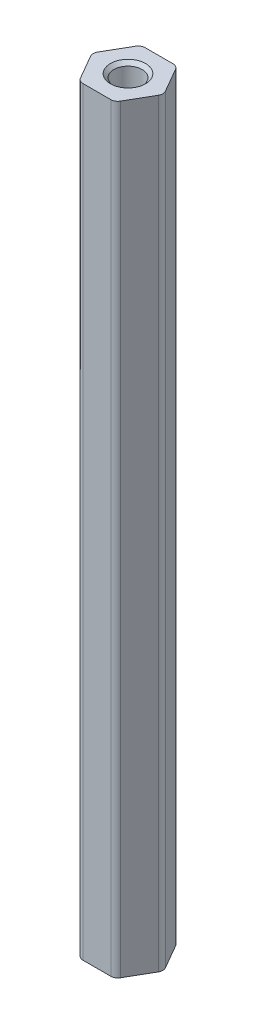
from build123d import *

# Parameters (mm, degrees)
BOSS_EXTRUDE1_DEPTH                = 55.0672
FILLET1_R                          = 0.508
M2_5X0_45_TAPPED_HOLE1_D           = 2.05
M2_5X0_45_TAPPED_HOLE1_CSINK_D     = 2.55
M2_5X0_45_TAPPED_HOLE1_CSINK_ANGLE = 90


with BuildPart() as part:
    # Sketch1 → Boss-Extrude1 (new body)
    with BuildSketch(Plane(origin=(0, 0, 0), x_dir=(1, 0, 0), z_dir=(0, 1, 0))):
        Polygon((-2.6035, 0), (-1.30175, 2.254697139), (1.30175, 2.254697139), (2.6035, 0), (1.30175, -2.254697139), (-1.30175, -2.254697139), align=None)
    extrude(amount=BOSS_EXTRUDE1_DEPTH)

    # Fillet1
    fillet1_edges = [part.edges().sort_by_distance(p)[0] for p in [
        (-2.6035, 27.5336, 0),
        (-1.30175, 27.5336, 2.254697139),
        (1.30175, 27.5336, 2.254697139),
        (2.6035, 27.5336, 0),
        (1.30175, 27.5336, -2.254697139),
        (-1.30175, 27.5336, -2.254697139),
    ]]
    fillet(fillet1_edges, radius=FILLET1_R)

    # M2.5x0.45 Tapped Hole1 (through all)
    with Locations(Plane.ZX.offset(55.0672)):
        with Locations((0, 0)):
            CounterSinkHole(M2_5X0_45_TAPPED_HOLE1_D / 2, M2_5X0_45_TAPPED_HOLE1_CSINK_D / 2, counter_sink_angle=M2_5X0_45_TAPPED_HOLE1_CSINK_ANGLE)


solid = part.part
